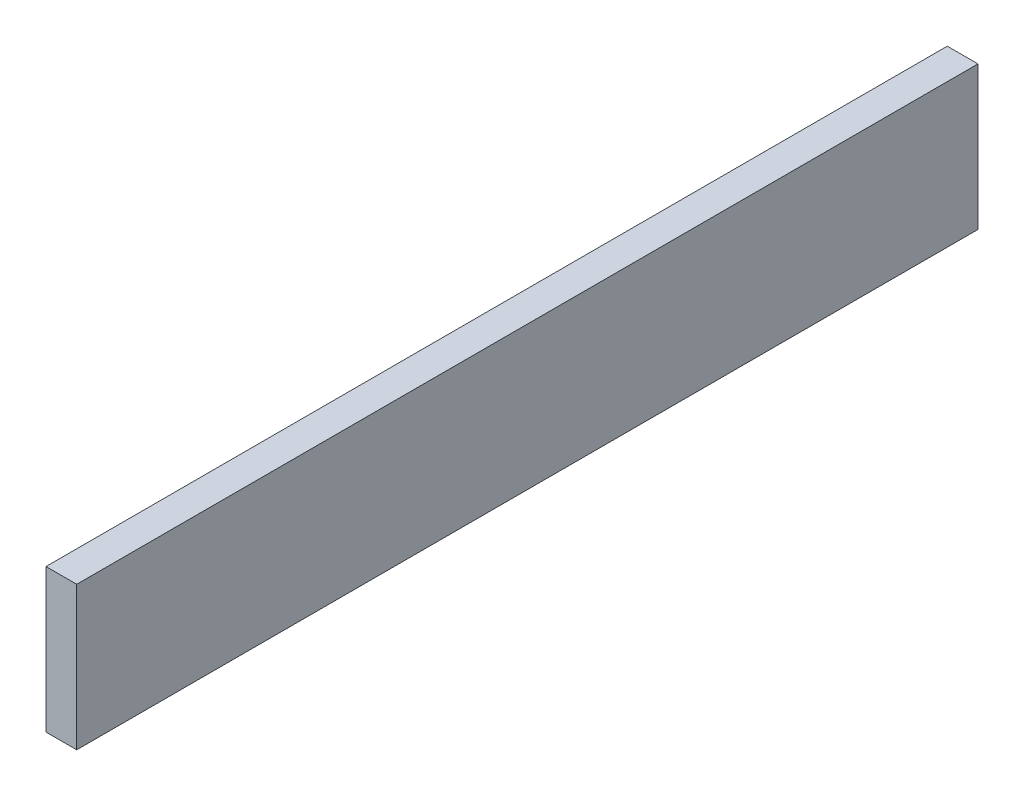
from build123d import *

# Parameters (mm, degrees)
SKETCH1_W           = 19.05
SKETCH1_H           = 88.9
BOSS_EXTRUDE1_DEPTH = 558.8


with BuildPart() as part:
    # Sketch1 → Boss-Extrude1 (new body)
    with BuildSketch(Plane.XY):
        with Locations((9.525, 44.45)):
            Rectangle(SKETCH1_W, SKETCH1_H)
    extrude(amount=BOSS_EXTRUDE1_DEPTH)


solid = part.part
